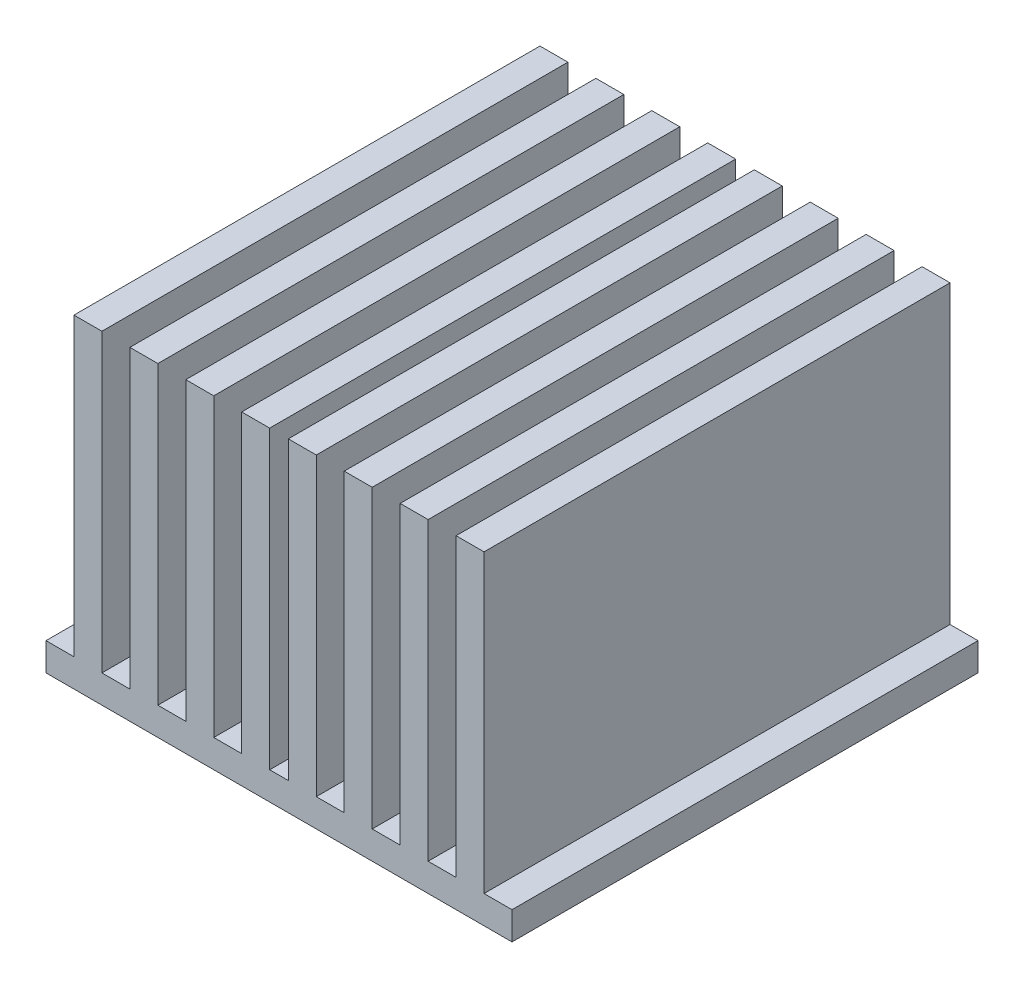
from build123d import *

# Parameters (mm, degrees)
SKETCH2_W           = 50
SKETCH2_H           = 50
BOSS_EXTRUDE1_DEPTH = 3
SKETCH3_W           = 3
SKETCH3_H           = 50
BOSS_EXTRUDE2_DEPTH = 31.75


with BuildPart() as part:
    # Sketch2 → Boss-Extrude1 (new body)
    with BuildSketch(Plane(origin=(0, 0, 0), x_dir=(1, 0, 0), z_dir=(0, 1, 0))):
        with Locations((25, 25)):
            Rectangle(SKETCH2_W, SKETCH2_H)
    extrude(amount=BOSS_EXTRUDE1_DEPTH)

    # Sketch3 → Boss-Extrude2 (add)
    with BuildSketch(Plane(origin=(0, 3, 0), x_dir=(1, 0, 0), z_dir=(0, 1, 0))):
        with Locations((4.5, 25)):
            Rectangle(SKETCH3_W, SKETCH3_H)
        with Locations((10.5, 25)):
            Rectangle(SKETCH3_W, SKETCH3_H)
        with Locations((16.5, 25)):
            Rectangle(SKETCH3_W, SKETCH3_H)
        with Locations((22.5, 25)):
            Rectangle(SKETCH3_W, SKETCH3_H)
    boss_extrude2 = extrude(amount=BOSS_EXTRUDE2_DEPTH)

    # Mirror1: Boss-Extrude2 across plane
    add(boss_extrude2.mirror(Plane.ZY.offset(-25)))


solid = part.part
